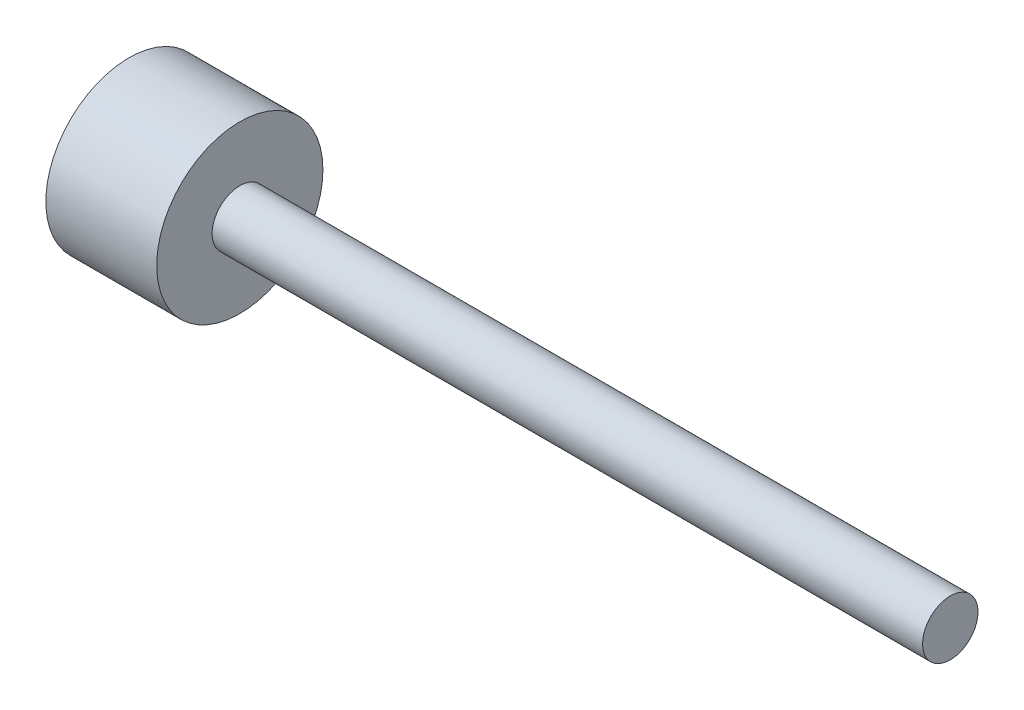
from build123d import *

# Parameters (mm, degrees)
SKETCH1_R           = 9.525
BOSS_EXTRUDE1_DEPTH = 12.7
BOSS_EXTRUDE2_START = -12.7
SKETCH2_R           = 3.175
BOSS_EXTRUDE2_DEPTH = 94.11


with BuildPart() as part:
    # Sketch1 → Boss-Extrude1 (new body)
    with BuildSketch(Plane(origin=(0, 0, 0), x_dir=(0, 0, -1), z_dir=(1, 0, 0))):
        Circle(SKETCH1_R)
    extrude(amount=BOSS_EXTRUDE1_DEPTH)

    # Sketch2 → Boss-Extrude2 (add)
    with BuildSketch(Plane(origin=(12.7, 0, 0), x_dir=(0, 0, -1), z_dir=(1, 0, 0)).offset(BOSS_EXTRUDE2_START)):
        Circle(SKETCH2_R)
    extrude(amount=BOSS_EXTRUDE2_DEPTH)


solid = part.part
